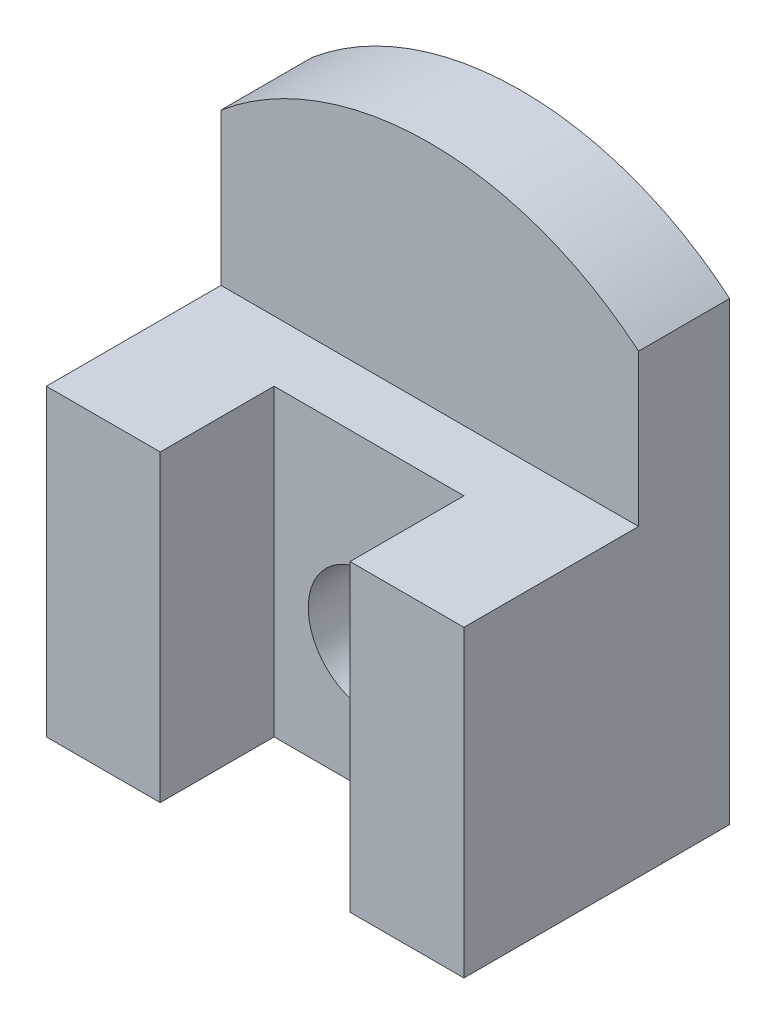
from build123d import *

# Parameters (mm, degrees)
BASE_EXTRUSION_DEPTH    = 35
ESQUISSE5_W             = 30
ESQUISSE5_H             = 30
ENL_V_MAT_EXTRU_5_DEPTH = 89.600225733
ESQUISSE6_W             = 25
ESQUISSE6_H             = 20
ENL_V_MAT_EXTRU_6_DEPTH = 99.615414617
ESQUISSE7_R             = 8
ENL_V_MAT_EXTRU_7_DEPTH = 88.177978871


with BuildPart() as part:
    # Esquisse1 → Base-Extrusion (new body)
    with BuildSketch(Plane.XY):
        with BuildLine():
            Line((-60, 0), (-60, -60))
            Line((-60, -60), (-5, -60))
            Line((-5, -60), (-5, 0))
            ThreePointArc((-5, 0), (-32.5, 10), (-60, 0))
        make_face()
    extrude(amount=BASE_EXTRUSION_DEPTH)

    # Esquisse5 → Enlèv. mat.-Extru.5 (cut, through all)
    with BuildSketch(Plane.ZY.offset(60)):
        with Locations((27, -5)):
            Rectangle(ESQUISSE5_W, ESQUISSE5_H)
    extrude(amount=-ENL_V_MAT_EXTRU_5_DEPTH, mode=Mode.SUBTRACT)

    # Esquisse6 → Enlèv. mat.-Extru.6 (cut, through all)
    with BuildSketch(Plane.XZ.offset(60)):
        with Locations((-32.5, 30)):
            Rectangle(ESQUISSE6_W, ESQUISSE6_H)
    extrude(amount=-ENL_V_MAT_EXTRU_6_DEPTH, mode=Mode.SUBTRACT)

    # Esquisse7 → Enlèv. mat.-Extru.7 (cut, through all)
    with BuildSketch(Plane.XY.offset(20)):
        with Locations((-32.5, -43)):
            Circle(ESQUISSE7_R)
    extrude(amount=-ENL_V_MAT_EXTRU_7_DEPTH, mode=Mode.SUBTRACT)


solid = part.part
